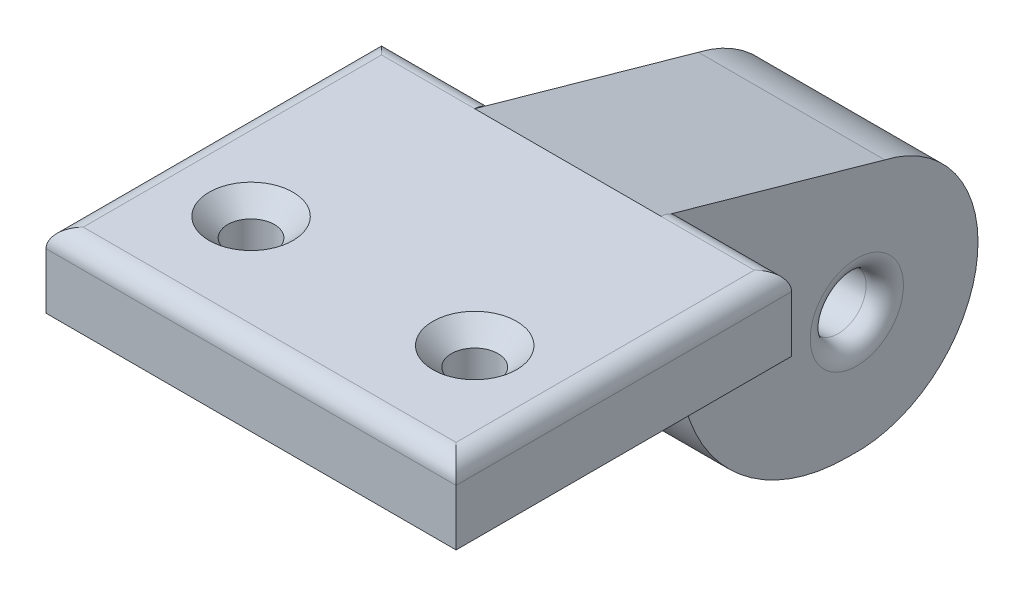
from build123d import *

# Parameters (mm, degrees)
SKETCH1_W           = 11
SKETCH1_H           = 18
SKETCH1_W_2         = 5
SKETCH1_H_2         = 11
BOSS_EXTRUDE1_DEPTH = 4
BOSS_EXTRUDE2_DEPTH = 5
SKETCH3_R           = 1.248430758
CUT_EXTRUDE1_DEPTH  = 5
FILLET1_R           = 1
FILLET3_R           = 2
FILLET4_R           = 9
CUT_EXTRUDE2_DEPTH  = 10
CHAMFER1_SIZE       = 1


with BuildPart() as part:
    # Sketch1 → Boss-Extrude1 (new body)
    with BuildSketch(Plane(origin=(0, 0, 0), x_dir=(1, 0, 0), z_dir=(0, 1, 0))):
        with Locations((-2.740875912, 16.357664234)):
            Rectangle(SKETCH1_W, SKETCH1_H)
        with Locations((-5.740875912, 30.857664234)):
            Rectangle(SKETCH1_W_2, SKETCH1_H_2)
    boss_extrude1 = extrude(amount=BOSS_EXTRUDE1_DEPTH)

    # Sketch2 → Boss-Extrude2 (add)
    with BuildSketch(Plane(origin=(-3.240875912, 0, 0), x_dir=(0, 0, -1), z_dir=(1, 0, 0))):
        with BuildLine():
            Line((34.537911903, 0), (25.357664234, 0))
            Line((25.357664234, 0), (25.357664234, -12.192130501))
            Line((25.357664234, -12.192130501), (34.537911903, -12.192130501))
            Line((34.537911903, -12.192130501), (34.537911903, -7.165523267))
            ThreePointArc((34.537911903, -7.165523267), (33.357664234, -5.7), (34.537911903, -4.234476733))
            Line((34.537911903, -4.234476733), (34.537911903, 0))
        make_face()
        with BuildLine():
            Line((36.357664234, 0), (34.537911903, 0))
            Line((34.537911903, 0), (34.537911903, -4.234476733))
            ThreePointArc((34.537911903, -4.234476733), (35.798507341, -4.531747353), (36.357664234, -5.7))
            ThreePointArc((36.357664234, -5.7), (35.798507341, -6.868252647), (34.537911903, -7.165523267))
            Line((34.537911903, -7.165523267), (34.537911903, -12.192130501))
            ThreePointArc((34.537911903, -12.192130501), (41.293121094, -6.613725887), (36.357664234, 0.62455532))
            Line((36.357664234, 0.62455532), (36.357664234, 0))
        make_face()
    boss_extrude2 = extrude(amount=-BOSS_EXTRUDE2_DEPTH)

    # Mirror1: Boss-Extrude1, Boss-Extrude2 across plane
    add(boss_extrude1.mirror(Plane(origin=(-8.240875912, 4, 0), x_dir=(0, 0, 1), z_dir=(1, 0, 0))))
    add(boss_extrude2.mirror(Plane(origin=(-8.240875912, 4, 0), x_dir=(0, 0, 1), z_dir=(1, 0, 0))))

    # Sketch3 → Cut-Extrude1 (cut)
    with BuildSketch(Plane(origin=(0, 4, 0), x_dir=(1, 0, 0), z_dir=(0, 1, 0))):
        with Locations(Location((-2.240875912, 13.357664234, 0), (0, 0, 270))):
            Circle(SKETCH3_R)
        with Locations(Location((-14.240875912, 13.357664234, 0), (0, 0, 270))):
            Circle(SKETCH3_R)
    extrude(amount=-CUT_EXTRUDE1_DEPTH, mode=Mode.SUBTRACT)

    # Fillet1
    fillet1_edges = [part.edges().sort_by_distance(p)[0] for p in [
        (-0.240875912, 4, -25.357664234),
        (-3.240875912, -4.234476733, -35.177416564),
        (-8.240875912, 4, -7.357664234),
        (-19.240875912, 4, -16.357664234),
        (-16.240875912, 4, -25.357664234),
        (2.759124088, 4, -16.357664234),
        (-13.240875912, -4.234476733, -35.177416564),
    ]]
    fillet(fillet1_edges, radius=FILLET1_R)

    # Fillet3
    fillet3_edges = [part.edges().sort_by_distance(p)[0] for p in [
        (-8.240875912, 0, -25.357664234),
    ]]
    fillet(fillet3_edges, radius=FILLET3_R)

    # Fillet4
    fillet4_edges = [part.edges().sort_by_distance(p)[0] for p in [
        (-8.240875912, -12.192130501, -25.357664234),
    ]]
    fillet(fillet4_edges, radius=FILLET4_R)

    # Sketch4 → Cut-Extrude2 (cut)
    with BuildSketch(Plane.ZY.offset(13.240875912)):
        Polygon((-36.357664234, 0.62455532), (-24.357664234, 4), (-36.357664234, 4), align=None)
    extrude(amount=-CUT_EXTRUDE2_DEPTH, mode=Mode.SUBTRACT)

    # Chamfer1
    chamfer1_edges = [part.edges().sort_by_distance(p)[0] for p in [
        (-2.240875912, 4, -14.606094992),
        (-14.240875912, 4, -14.606094992),
    ]]
    chamfer(chamfer1_edges, length=CHAMFER1_SIZE)


solid = part.part
